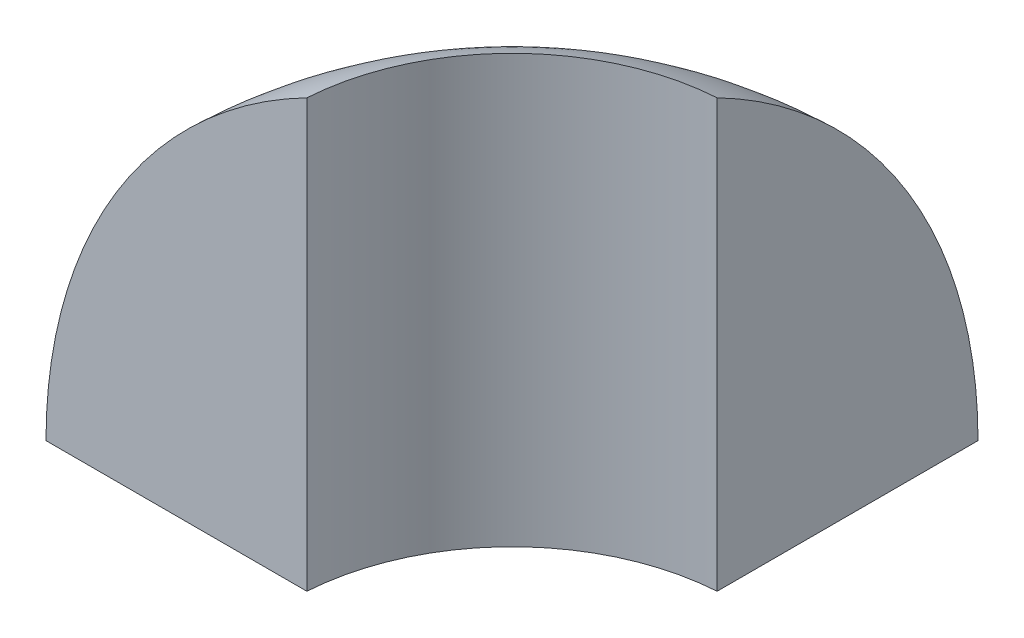
from build123d import *

# Parameters (mm, degrees)
CUT_EXTRUDE1_DEPTH      = 29.752043406
CUT_EXTRUDE1_DEPTH_BACK = 29.752043406
SKETCH3_W               = 19.816571208
SKETCH3_H               = 17.600838627
CUT_EXTRUDE2_DEPTH      = 29.448858181
SKETCH6_R               = 7.6
CUT_EXTRUDE3_DEPTH      = 29.734648075


with BuildPart() as part:
    # Sketch1 → Revolve1 (revolve)
    with BuildSketch(Plane.XY):
        with BuildLine():
            Line((0, 16.6), (0, -16.6))
            ThreePointArc((0, -16.6), (-16.6, 0), (0, 16.6))
        make_face()
    revolve(axis=Axis((0, 16.6, 0), (0, -1, 0)))

    # Sketch2 → Cut-Extrude1 (cut, two sides: drawn at the far end of the back side and taken through both)
    with BuildSketch(Plane(origin=(0, 0, 0), x_dir=(1, 0, 0), z_dir=(0, 1, 0)).offset(-CUT_EXTRUDE1_DEPTH_BACK)):
        with BuildLine():
            Line((-0.5, 16.592468171), (-0.5, 0.5))
            Line((-0.5, 0.5), (-16.592468171, 0.5))
            ThreePointArc((-16.592468171, 0.5), (11.737972568, -11.737972568), (-0.5, 16.592468171))
        make_face()
    extrude(amount=CUT_EXTRUDE1_DEPTH + CUT_EXTRUDE1_DEPTH_BACK, mode=Mode.SUBTRACT)

    # Sketch3 → Cut-Extrude2 (cut, through all)
    with BuildSketch(Plane(origin=(-0.5, 0, 0), x_dir=(0, 0, -1), z_dir=(1, 0, 0))):
        with Locations((9.908285604, -8.800419314)):
            Rectangle(SKETCH3_W, SKETCH3_H)
    extrude(amount=-CUT_EXTRUDE2_DEPTH, mode=Mode.SUBTRACT)

    # Sketch6 → Cut-Extrude3 (cut, through all)
    with BuildSketch(Plane.XZ):
        Circle(SKETCH6_R)
    extrude(amount=-CUT_EXTRUDE3_DEPTH, mode=Mode.SUBTRACT)


solid = part.part
